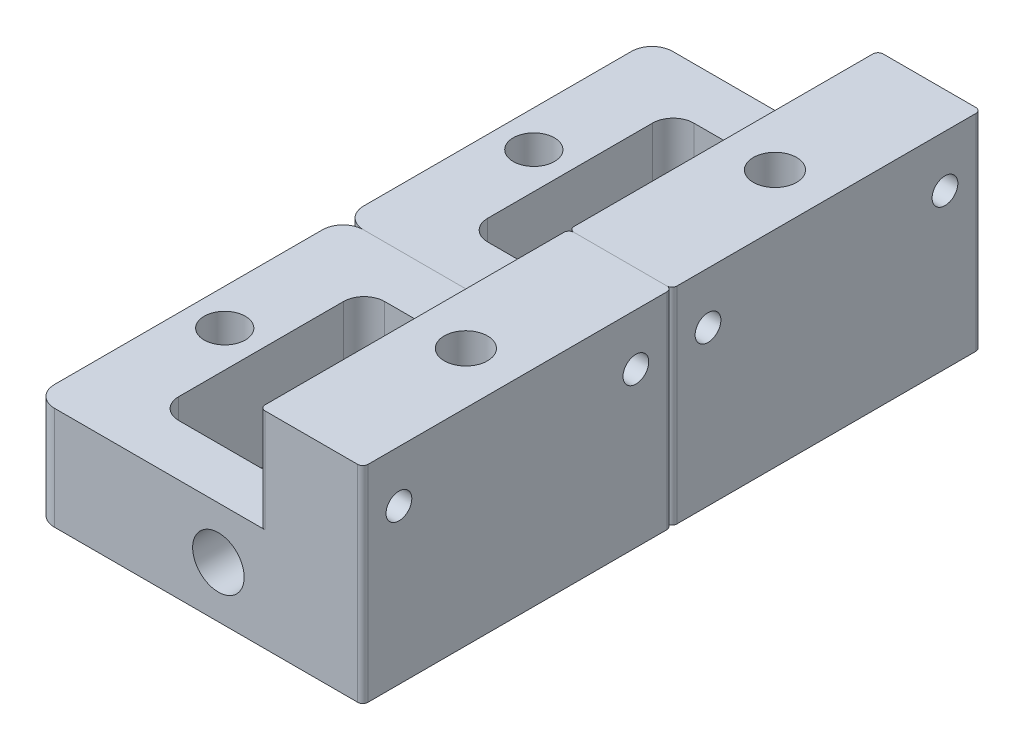
from build123d import *

# Parameters (mm, degrees)
SKETCH1_W                   = 31.93
SKETCH1_H                   = 30
SKETCH1_W_2                 = 14.88
SKETCH1_H_2                 = 20
BOSS_EXTRUDE1_DEPTH         = 10
SKETCH2_W                   = 10
SKETCH2_H                   = 30
BOSS_EXTRUDE2_DEPTH         = 10
TAP_DRILL_FOR_M5X0_8_TAP1_D = 4.2
FILLET2_R                   = 2
SKETCH5_R                   = 2.5
CUT_EXTRUDE2_DEPTH          = 37.457558887
TAP_DRILL_FOR_M4X0_7_TAP1_D = 3.3
FILLET3_R                   = 2
FILLET4_R                   = 0.5
TAP_DRILL_FOR_M3X0_5_TAP1_D = 2.5
F_4_0_4_DIAMETER_HOLE1_D    = 4


with BuildPart() as part:
    # Sketch1 → Boss-Extrude1 (new body)
    with BuildSketch(Plane(origin=(0, 0, 0), x_dir=(1, 0, 0), z_dir=(0, 1, 0))):
        with Locations((1.475, 0)):
            Rectangle(SKETCH1_W, SKETCH1_H)
        Rectangle(SKETCH1_W_2, SKETCH1_H_2, mode=Mode.SUBTRACT)
    extrude(amount=BOSS_EXTRUDE1_DEPTH)

    # Sketch2 → Boss-Extrude2 (add)
    with BuildSketch(Plane(origin=(0, 10, 0), x_dir=(1, 0, 0), z_dir=(0, 1, 0))):
        with Locations((12.44, 0)):
            Rectangle(SKETCH2_W, SKETCH2_H)
    extrude(amount=BOSS_EXTRUDE2_DEPTH)

    # Tap Drill for M5x0.8 Tap1 (through all)
    with Locations(Plane(origin=(0, 20, 0), x_dir=(1, 0, 0), z_dir=(0, 1, 0))):
        with Locations((12.44, 0)):
            Hole(TAP_DRILL_FOR_M5X0_8_TAP1_D / 2)

    # Fillet2
    fillet2_edges = [part.edges().sort_by_distance(p)[0] for p in [
        (-7.44, 5, -10),
        (-7.44, 5, 10),
        (7.44, 5, 10),
        (7.44, 5, -10),
    ]]
    fillet(fillet2_edges, radius=FILLET2_R)

    # Sketch5 → Cut-Extrude2 (cut, through all)
    with BuildSketch(Plane.XY.offset(-10)):
        with Locations(Location((3.42, 5, 0), (0, 0, 323.900983741))):
            Circle(SKETCH5_R)
    extrude(amount=CUT_EXTRUDE2_DEPTH, mode=Mode.SUBTRACT)

    # Tap Drill for M4x0.7 Tap1 (through all)
    with Locations(Plane.XY.offset(-10)):
        with Locations((3.42, 5)):
            Hole(TAP_DRILL_FOR_M4X0_7_TAP1_D / 2)

    # Fillet3
    fillet3_edges = [part.edges().sort_by_distance(p)[0] for p in [
        (-14.49, 5, -15),
        (-14.49, 5, 15),
    ]]
    fillet(fillet3_edges, radius=FILLET3_R)

    # Fillet4
    fillet4_edges = [part.edges().sort_by_distance(p)[0] for p in [
        (7.44, 15, -15),
        (7.44, 15, 15),
        (17.44, 10, -15),
        (17.44, 10, 15),
    ]]
    fillet(fillet4_edges, radius=FILLET4_R)

    # Tap Drill for M3x0.5 Tap1 (through all)
    with Locations(Plane.ZY.offset(-7.44)):
        with Locations((-11.5, 15), (11.5, 15)):
            Hole(TAP_DRILL_FOR_M3X0_5_TAP1_D / 2)

    # Ø4.0 (4) Diameter Hole1 (through all)
    with Locations(Plane(origin=(0, 10, 0), x_dir=(1, 0, 0), z_dir=(0, 1, 0))):
        with Locations((-10.965, 0)):
            Hole(F_4_0_4_DIAMETER_HOLE1_D / 2)


with BuildPart() as body_2:
    # Mirror1: mirrored copy
    add(part.part.mirror(Plane(origin=(17.44, 10, -15), x_dir=(1, 0, 0), z_dir=(0, 0, 1))))


solid = Compound([part.part, body_2.part])
